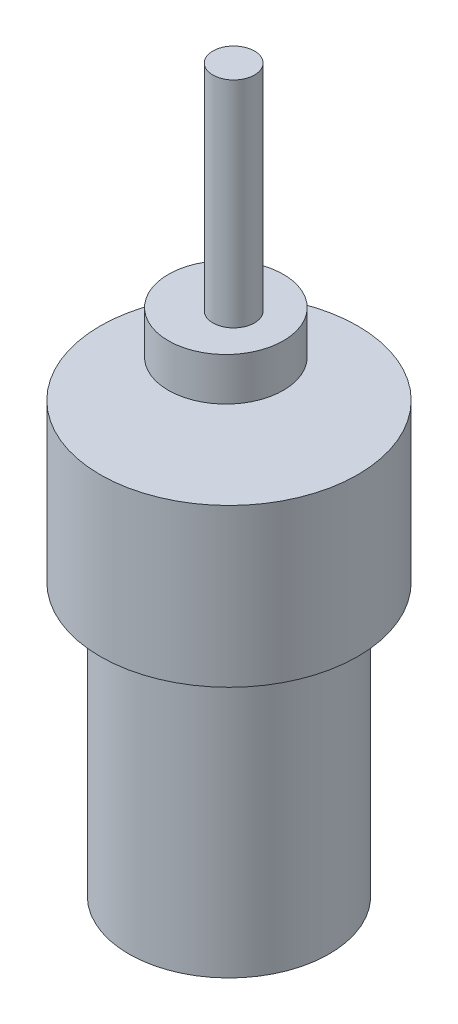
from build123d import *

# Parameters (mm, degrees)
SKETCH2_R           = 14
BOSS_EXTRUDE1_DEPTH = 38
SKETCH3_R           = 18
BOSS_EXTRUDE2_DEPTH = 22
SKETCH4_R           = 8.03806557
BOSS_EXTRUDE3_DEPTH = 6
SKETCH5_R           = 2.907591927
BOSS_EXTRUDE4_DEPTH = 30


with BuildPart() as part:
    # Sketch2 → Boss-Extrude1 (new body)
    with BuildSketch(Plane(origin=(0, 0, 0), x_dir=(1, 0, 0), z_dir=(0, 1, 0))):
        with Locations(Location((0, 0, 0), (0, 0, 270))):
            Circle(SKETCH2_R)
    extrude(amount=BOSS_EXTRUDE1_DEPTH)

    # Sketch3 → Boss-Extrude2 (add)
    with BuildSketch(Plane(origin=(0, 38, 0), x_dir=(1, 0, 0), z_dir=(0, 1, 0))):
        with Locations(Location((0, 0, 0), (0, 0, 270))):
            Circle(SKETCH3_R)
    extrude(amount=BOSS_EXTRUDE2_DEPTH)

    # Sketch4 → Boss-Extrude3 (add)
    with BuildSketch(Plane(origin=(0, 60, 0), x_dir=(1, 0, 0), z_dir=(0, 1, 0))):
        with Locations(Location((-5.440165361, 5.002879216, 0), (0, 0, 270))):
            Circle(SKETCH4_R)
    extrude(amount=BOSS_EXTRUDE3_DEPTH)

    # Sketch5 → Boss-Extrude4 (add)
    with BuildSketch(Plane(origin=(0, 66, 0), x_dir=(1, 0, 0), z_dir=(0, 1, 0))):
        with Locations(Location((-4.484153768, 5.138834881, 0), (0, 0, 270))):
            Circle(SKETCH5_R)
    extrude(amount=BOSS_EXTRUDE4_DEPTH)


solid = part.part
